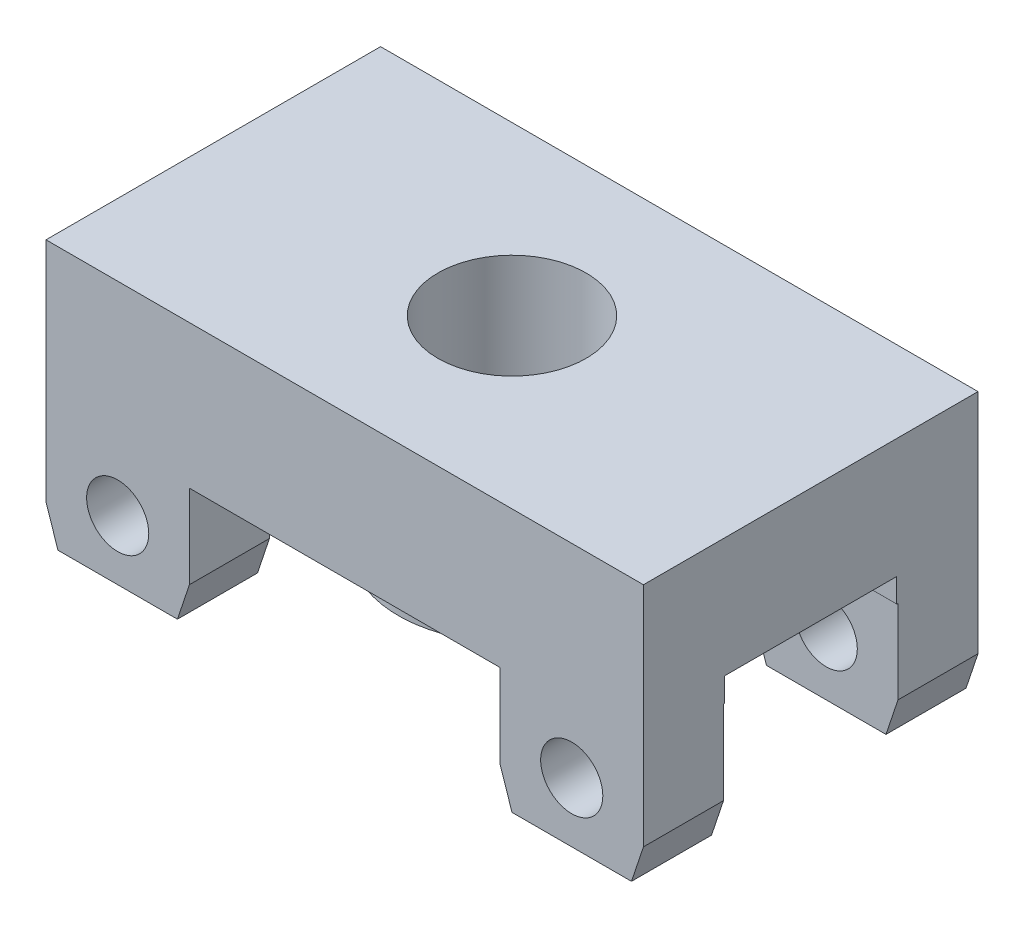
from build123d import *

# Parameters (mm, degrees)
SKETCH_1_W                 = 50
SKETCH_1_H                 = 12
UPPER_CROSSBAR_DEPTH       = 28
SKETCH_2_R                 = 9.5
LOWER_GUIDE_SLEEVE_DEPTH   = 5
SKETCH_3_R                 = 6.2
SPINDLE_THROUGH_BORE_DEPTH = 60.774576536
UPPER_HINGE_EAR_DEPTH      = 6.7
SKETCH_6_R                 = 2.6
UPPER_HINGE_BORE_DEPTH     = 59.549124673
EXTRUDE_2_DEPTH            = 6.7
SKETCH_8_R                 = 2.6
CUT_EXTRUDE_2_DEPTH        = 59.549124673
OPPOSITE_HINGE_EAR_DEPTH   = 6.7
SKETCH_10_R                = 2.6
OPPOSITE_HINGE_BORE_DEPTH  = 59.549124673
EXTRUDE_4_DEPTH            = 6.7
SKETCH_12_R                = 2.6
CUT_EXTRUDE_4_DEPTH        = 59.549124673
SKETCH_14_W                = 20
SKETCH_14_H                = 2.2
ARM_SWING_CLEARANCE_DEPTH  = 7.2
SKETCH_15_W                = 20
SKETCH_15_H                = 2.2
CUT_EXTRUDE_6_DEPTH        = 7.2


with BuildPart() as part:
    # 草图1 → Upper_crossbar (new body)
    with BuildSketch(Plane.XY):
        with Locations((25, 6)):
            Rectangle(SKETCH_1_W, SKETCH_1_H)
    extrude(amount=UPPER_CROSSBAR_DEPTH)

    # 草图2 → Lower_guide_sleeve (add)
    with BuildSketch(Plane.XZ):
        with Locations(Location((25, 14, 0), (0, 0, 270))):
            Circle(SKETCH_2_R)
    extrude(amount=LOWER_GUIDE_SLEEVE_DEPTH)

    # 草图3 → Spindle_through_bore (cut, through all)
    with BuildSketch(Plane(origin=(0, 12, 0), x_dir=(1, 0, 0), z_dir=(0, 1, 0))):
        with Locations(Location((25, -14, 0), (0, 0, 270))):
            Circle(SKETCH_3_R)
    extrude(amount=-SPINDLE_THROUGH_BORE_DEPTH, mode=Mode.SUBTRACT)

    # 草图5 → Upper_hinge_ear (add)
    with BuildSketch(Plane.XY.offset(21.3)):
        Polygon((1, -10), (11, -10), (12, -7), (12, 1), (0, 1), (0, -7), align=None)
    extrude(amount=UPPER_HINGE_EAR_DEPTH)

    # 草图6 → Upper_hinge_bore (cut, through all)
    with BuildSketch(Plane.XY.offset(28)):
        with Locations((6, -5)):
            Circle(SKETCH_6_R)
    extrude(amount=-UPPER_HINGE_BORE_DEPTH, mode=Mode.SUBTRACT)

    # 草图7 → 凸台-拉伸2 (add)
    with BuildSketch(Plane.XY.offset(21.3)):
        Polygon((39, -10), (49, -10), (50, -7), (50, 1), (38, 1), (38, -7), align=None)
    extrude(amount=EXTRUDE_2_DEPTH)

    # 草图8 → 切除-拉伸2 (cut, through all)
    with BuildSketch(Plane.XY.offset(28)):
        with Locations((44, -5)):
            Circle(SKETCH_8_R)
    extrude(amount=-CUT_EXTRUDE_2_DEPTH, mode=Mode.SUBTRACT)

    # 草图9 → Opposite_hinge_ear (add)
    with BuildSketch(Plane.XY):
        Polygon((1, -10), (11, -10), (12, -7), (12, 1), (0, 1), (0, -7), align=None)
    extrude(amount=OPPOSITE_HINGE_EAR_DEPTH)

    # 草图10 → Opposite_hinge_bore (cut, through all)
    with BuildSketch(Plane(origin=(0, 0, 0), x_dir=(-1, 0, 0), z_dir=(0, 0, -1))):
        with Locations(Location((-6, -5, 0), (0, 0, 180))):
            Circle(SKETCH_10_R)
    extrude(amount=-OPPOSITE_HINGE_BORE_DEPTH, mode=Mode.SUBTRACT)

    # 草图11 → 凸台-拉伸4 (add)
    with BuildSketch(Plane.XY):
        Polygon((39, -10), (49, -10), (50, -7), (50, 1), (38, 1), (38, -7), align=None)
    extrude(amount=EXTRUDE_4_DEPTH)

    # 草图12 → 切除-拉伸4 (cut, through all)
    with BuildSketch(Plane(origin=(0, 0, 0), x_dir=(-1, 0, 0), z_dir=(0, 0, -1))):
        with Locations(Location((-44, -5, 0), (0, 0, 180))):
            Circle(SKETCH_12_R)
    extrude(amount=-CUT_EXTRUDE_4_DEPTH, mode=Mode.SUBTRACT)

    # 草图14 → Arm_swing_clearance (cut, symmetric)
    with BuildSketch(Plane.XY.offset(14)):
        with Locations((8, 0.9)):
            Rectangle(SKETCH_14_W, SKETCH_14_H)
    extrude(amount=ARM_SWING_CLEARANCE_DEPTH, both=True, mode=Mode.SUBTRACT)

    # 草图15 → 切除-拉伸6 (cut, symmetric)
    with BuildSketch(Plane.XY.offset(14)):
        with Locations((42, 0.9)):
            Rectangle(SKETCH_15_W, SKETCH_15_H)
    extrude(amount=CUT_EXTRUDE_6_DEPTH, both=True, mode=Mode.SUBTRACT)


solid = part.part
